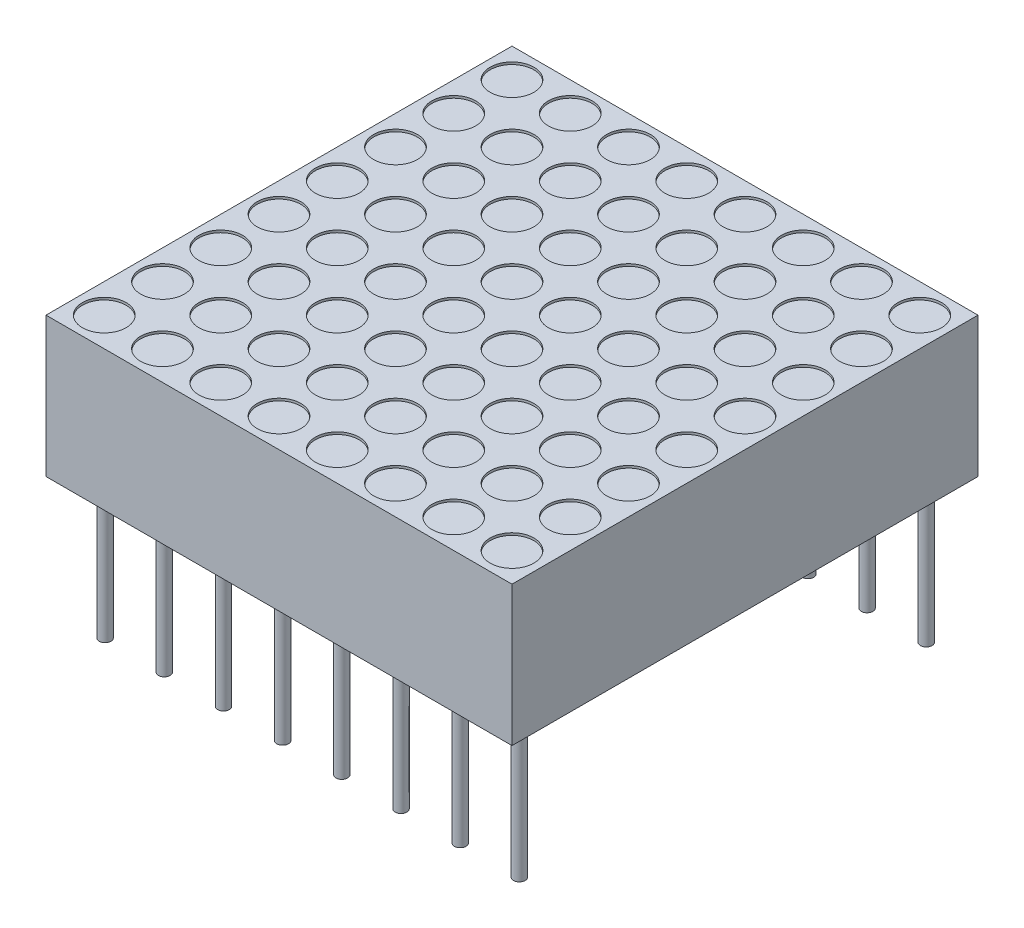
from build123d import *

# Parameters (mm, degrees)
SALIENTE_EXTRUIR1_DEPTH      = 3
SALIENTE_EXTRUIR1_DEPTH_BACK = 3
CROQUIS1_W                   = 20
CROQUIS1_H                   = 20
CROQUIS2_R                   = 0.9375
CORTAR_EXTRUIR4_DEPTH        = 0.1
MATRIZL1_COUNT               = 8
MATRIZL1_PITCH               = 2.5
MATRIZL1_COUNT_DIR2          = 8
MATRIZL1_PITCH_DIR2          = 2.5
CROQUIS4_R                   = 0.25
SALIENTE_EXTRUIR2_DEPTH      = 6
MATRIZL2_COUNT               = 8
MATRIZL2_PITCH               = 2.54
MATRIZL2_COUNT_DIR2          = 2
MATRIZL2_PITCH_DIR2          = 17.4625


with BuildPart() as part:
    # Croquis1 → Saliente-Extruir1 (new, two sides: drawn at the far end of the back side and taken through both)
    with BuildSketch(Plane(origin=(0, 0, 0), x_dir=(1, 0, 0), z_dir=(0, 1, 0)).offset(-SALIENTE_EXTRUIR1_DEPTH_BACK)):
        Rectangle(CROQUIS1_W, CROQUIS1_H)
    extrude(amount=SALIENTE_EXTRUIR1_DEPTH + SALIENTE_EXTRUIR1_DEPTH_BACK)

    # Croquis2 → Cortar-Extruir4 (cut)
    with BuildSketch(Plane(origin=(0, 3, 0), x_dir=(1, 0, 0), z_dir=(0, 1, 0))):
        with Locations((-8.75, 8.75)):
            Circle(CROQUIS2_R)
    cortar_extruir4 = extrude(amount=-CORTAR_EXTRUIR4_DEPTH, mode=Mode.SUBTRACT)

    # MatrizL1: Cortar-Extruir4 8 × 8
    with Locations(*[(i * MATRIZL1_PITCH, 0, j * MATRIZL1_PITCH_DIR2) for i in range(MATRIZL1_COUNT) for j in range(MATRIZL1_COUNT_DIR2) if (i, j) != (0, 0)]):
        add(cortar_extruir4, mode=Mode.SUBTRACT)

    # Croquis4 → Saliente-Extruir2 (add)
    with BuildSketch(Plane(origin=(0, -3, 0), x_dir=(-1, 0, 0), z_dir=(0, -1, 0))):
        with Locations((8.73125, -8.73125)):
            Circle(CROQUIS4_R)
    saliente_extruir2 = extrude(amount=SALIENTE_EXTRUIR2_DEPTH)

    # MatrizL2: Saliente-Extruir2 8 × 2
    with Locations(*[(i * MATRIZL2_PITCH, 0, -j * MATRIZL2_PITCH_DIR2) for i in range(MATRIZL2_COUNT) for j in range(MATRIZL2_COUNT_DIR2) if (i, j) != (0, 0)]):
        add(saliente_extruir2)


solid = part.part
